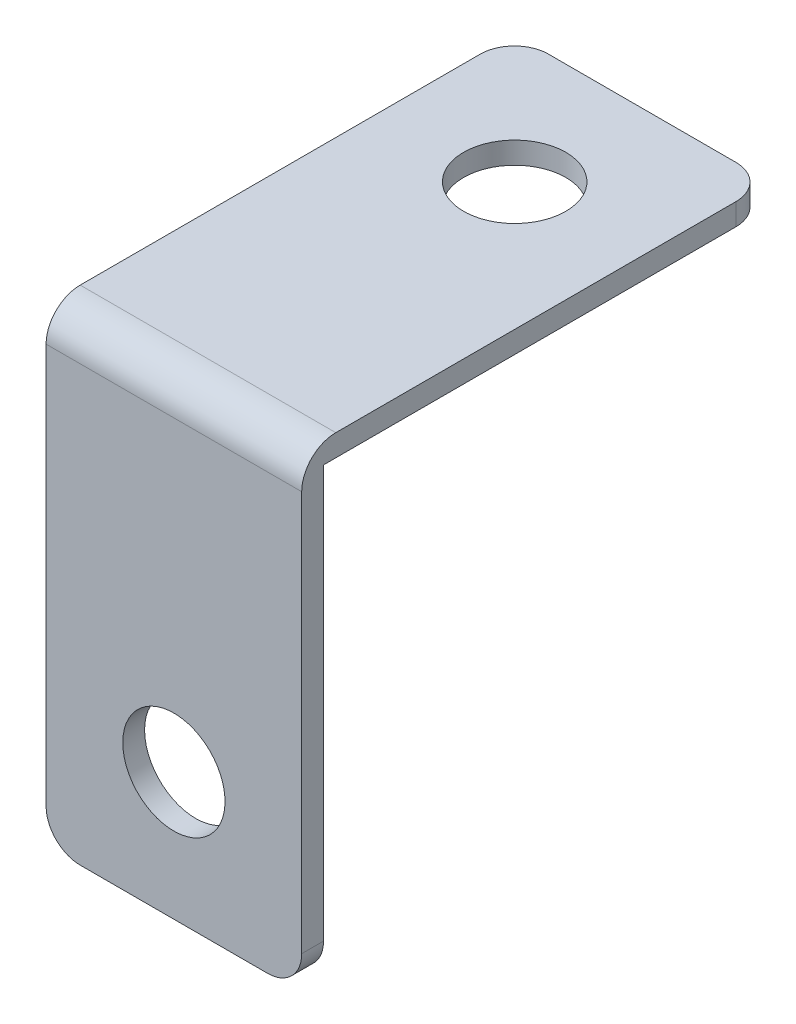
from build123d import *

# Parameters (mm, degrees)
SKETCH1_W           = 9.525
SKETCH1_H           = 0.8128
BOSS_EXTRUDE1_DEPTH = 17.4498
SKETCH2_W           = 9.525
SKETCH2_H           = 0.8128
BOSS_EXTRUDE2_DEPTH = 17.4498
SKETCH3_R           = 1.905
CUT_EXTRUDE1_DEPTH  = 17.4498
SKETCH4_R           = 1.905
CUT_EXTRUDE2_DEPTH  = 17.4498
FILLET1_R           = 1.27


with BuildPart() as part:
    # Sketch1 → Boss-Extrude1 (new body)
    with BuildSketch(Plane.XY):
        with Locations((4.7625, 0.4064)):
            Rectangle(SKETCH1_W, SKETCH1_H)
    extrude(amount=BOSS_EXTRUDE1_DEPTH)

    # Sketch2 → Boss-Extrude2 (add)
    with BuildSketch(Plane(origin=(0, 0.8128, 0), x_dir=(1, 0, 0), z_dir=(0, 1, 0))):
        with Locations((4.7625, -17.0434)):
            Rectangle(SKETCH2_W, SKETCH2_H)
    extrude(amount=-BOSS_EXTRUDE2_DEPTH)

    # Sketch3 → Cut-Extrude1 (cut)
    with BuildSketch(Plane.XZ):
        with Locations(Location((4.7625, 4.7498, 0), (0, 0, 270))):
            Circle(SKETCH3_R)
    extrude(amount=-CUT_EXTRUDE1_DEPTH, mode=Mode.SUBTRACT)

    # Sketch4 → Cut-Extrude2 (cut)
    with BuildSketch(Plane(origin=(0, 0, 16.637), x_dir=(-1, 0, 0), z_dir=(0, 0, -1))):
        with Locations((-4.7625, -11.8872)):
            Circle(SKETCH4_R)
    extrude(amount=-CUT_EXTRUDE2_DEPTH, mode=Mode.SUBTRACT)

    # Fillet1
    fillet1_edges = [part.edges().sort_by_distance(p)[0] for p in [
        (4.7625, 0.8128, 17.4498),
        (0, -16.637, 17.0434),
        (9.525, -16.637, 17.0434),
        (9.525, 0.4064, 0),
        (0, 0.4064, 0),
    ]]
    fillet(fillet1_edges, radius=FILLET1_R)


solid = part.part
